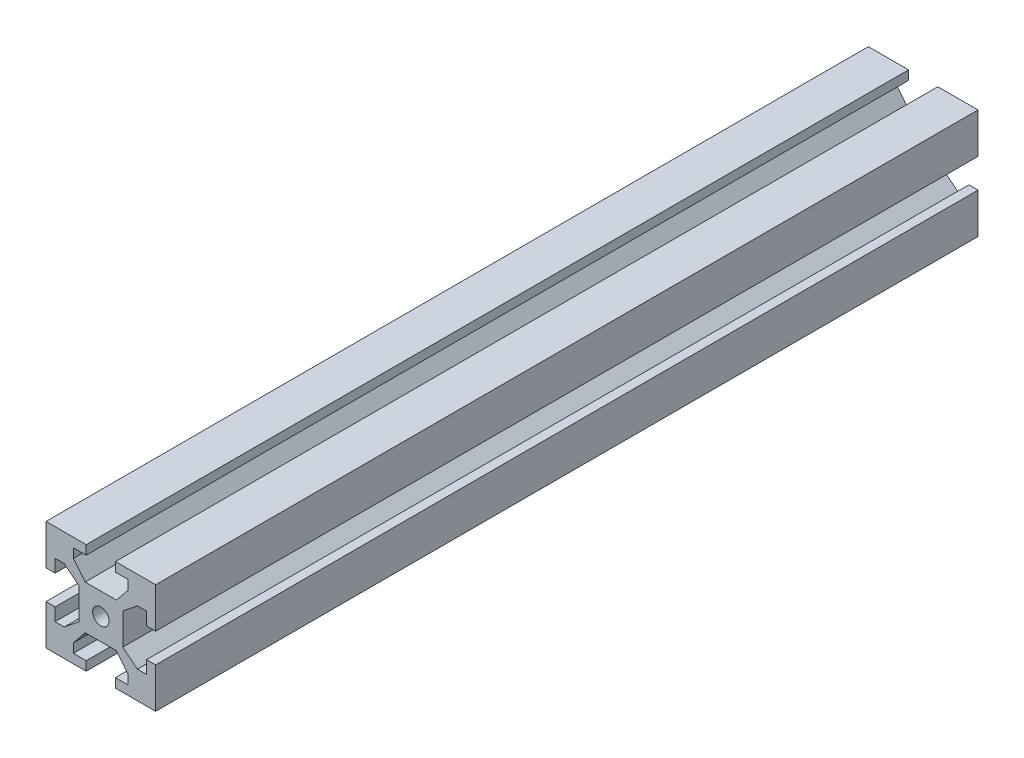
from build123d import *

# Parameters (mm, degrees)
SKETCH1_R           = 1.5
BOSS_EXTRUDE1_DEPTH = 75


with BuildPart() as part:
    # Sketch1 → Boss-Extrude1 (new, symmetric)
    with BuildSketch(Plane.XY):
        Polygon((10, 10), (2.666666667, 10), (2.666666667, 8.333333333), (5, 8.333333333), (5, 6.666666667), (2.857142857, 4), (-2.857142857, 4), (-5, 6.666666667), (-5, 8.333333333), (-2.666666667, 8.333333333), (-2.666666667, 10), (-10, 10), (-10, 2.666666667), (-8.333333333, 2.666666667), (-8.333333333, 5), (-6.666666667, 5), (-4, 2.857142857), (-4, -2.857142857), (-6.666666667, -5), (-8.333333333, -5), (-8.333333333, -2.666666667), (-10, -2.666666667), (-10, -10), (-2.666666667, -10), (-2.666666667, -8.333333333), (-5, -8.333333333), (-5, -6.666666667), (-2.857142857, -4), (2.857142857, -4), (5, -6.666666667), (5, -8.333333333), (2.666666667, -8.333333333), (2.666666667, -10), (10, -10), (10, -2.666666667), (8.333333333, -2.666666667), (8.333333333, -5), (6.666666667, -5), (4, -2.857142857), (4, 2.857142857), (6.666666667, 5), (8.333333333, 5), (8.333333333, 2.666666667), (10, 2.666666667), align=None)
        Circle(SKETCH1_R, mode=Mode.SUBTRACT)
    extrude(amount=BOSS_EXTRUDE1_DEPTH, both=True)


solid = part.part
